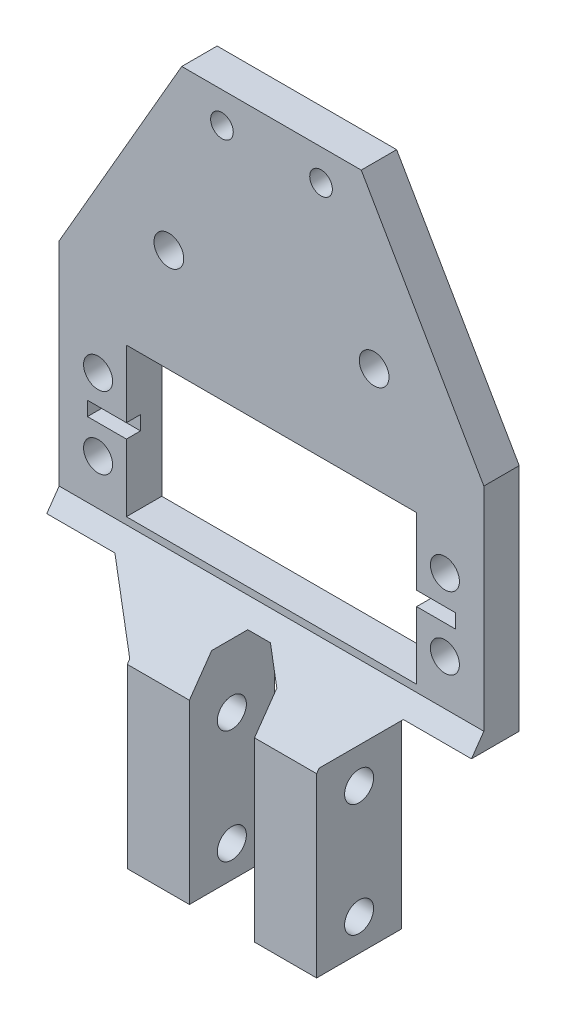
from build123d import *

# Parameters (mm, degrees)
SKETCH2_R           = 2.05
BOSS_EXTRUDE1_DEPTH = 30
CUT_EXTRUDE1_START  = -12.5
SKETCH3_W           = 9.2
SKETCH3_H           = 15
SKETCH3_W_2         = 33.25
CUT_EXTRUDE1_DEPTH  = 32.5
CHAMFER1_SIZE       = 3
CHAMFER2_SIZE       = 7
SKETCH4_R           = 2.05
SKETCH4_W           = 21
SKETCH4_H           = 41
CUT_EXTRUDE2_DEPTH  = 30
SKETCH5_R           = 2.1
SKETCH5_R_2         = 1.6
CUT_EXTRUDE3_DEPTH  = 10
CUT_EXTRUDE4_DEPTH  = 10
CUT_EXTRUDE6_START  = -1
SKETCH8_W           = 2
SKETCH8_H           = 52
CUT_EXTRUDE6_DEPTH  = 2


with BuildPart() as part:
    # Sketch2 → Boss-Extrude1 (new, symmetric)
    with BuildSketch(Plane.YZ):
        Polygon((-12.5, 6), (12.5, 6), (22.5, -1), (82.5, -1), (82.5, -6), (12.5, -6), (-12.5, -6), align=None)
        with Locations(Location((-8, 0, 0), (0, 0, 270))):
            Circle(SKETCH2_R, mode=Mode.SUBTRACT)
        with Locations(Location((8, 0, 0), (0, 0, 90))):
            Circle(SKETCH2_R, mode=Mode.SUBTRACT)
    extrude(amount=BOSS_EXTRUDE1_DEPTH, both=True)

    # Sketch3 → Cut-Extrude1 (cut)
    with BuildSketch(Plane(origin=(0, 0, 0), x_dir=(-1, 0, 0), z_dir=(0, 1, 0)).offset(CUT_EXTRUDE1_START)):
        Rectangle(SKETCH3_W, SKETCH3_H)
        with Locations((-30, 0)):
            Rectangle(SKETCH3_W_2, SKETCH3_H)
        with Locations((30, 0)):
            Rectangle(SKETCH3_W_2, SKETCH3_H)
    extrude(amount=CUT_EXTRUDE1_DEPTH, mode=Mode.SUBTRACT)

    # Chamfer1
    chamfer1_edges = [part.edges().sort_by_distance(p)[0] for p in [
        (-4.6, 20, -2.625),
        (4.6, 20, -2.625),
    ]]
    chamfer(chamfer1_edges, length=CHAMFER1_SIZE)

    # Chamfer2
    chamfer2_edges = [part.edges().sort_by_distance(p)[0] for p in [
        (-13.375, 20, -2.625),
        (13.375, 20, -2.625),
    ]]
    chamfer(chamfer2_edges, length=CHAMFER2_SIZE)

    # Sketch4 → Cut-Extrude2 (cut)
    with BuildSketch(Plane(origin=(0, 0, 0), x_dir=(0, 1, 0), z_dir=(0, 0, 1))):
        with Locations(Location((39.1, 24.5, 0), (0, 0, 270))):
            Circle(SKETCH4_R)
        with Locations(Location((28.9, 24.5, 0), (0, 0, 270))):
            Circle(SKETCH4_R)
        with Locations(Location((28.9, -24.5, 0), (0, 0, 270))):
            Circle(SKETCH4_R)
        with Locations(Location((39.1, -24.5, 0), (0, 0, 270))):
            Circle(SKETCH4_R)
        with Locations((34, 0)):
            Rectangle(SKETCH4_W, SKETCH4_H)
    extrude(amount=-CUT_EXTRUDE2_DEPTH, mode=Mode.SUBTRACT)

    # Sketch5 → Cut-Extrude3 (cut)
    with BuildSketch(Plane(origin=(0, 0, 0), x_dir=(0, 1, 0), z_dir=(0, 0, 1))):
        with Locations(Location((59.1, 14.5, 0), (0, 0, 270))):
            Circle(SKETCH5_R)
        with Locations(Location((59.1, -14.5, 0), (0, 0, 270))):
            Circle(SKETCH5_R)
        with Locations(Location((78.1, 7, 0), (0, 0, 270))):
            Circle(SKETCH5_R_2)
        with Locations(Location((78.1, -7, 0), (0, 0, 270))):
            Circle(SKETCH5_R_2)
    extrude(amount=-CUT_EXTRUDE3_DEPTH, mode=Mode.SUBTRACT)

    # Sketch6 → Cut-Extrude4 (cut)
    with BuildSketch(Plane(origin=(0, 0, 0), x_dir=(0, 1, 0), z_dir=(0, 0, 1))):
        Polygon((52.5, 30), (82.5, 12.679491924), (82.5, -12.679491924), (52.5, -30), (52.5, -35), (87.5, -35), (87.5, 35), (52.5, 35), align=None)
    extrude(amount=-CUT_EXTRUDE4_DEPTH, mode=Mode.SUBTRACT)

    # Sketch8 → Cut-Extrude6 (cut)
    with BuildSketch(Plane(origin=(0, 0, 0), x_dir=(0, 1, 0), z_dir=(0, 0, 1)).offset(CUT_EXTRUDE6_START)):
        with Locations((34, 0)):
            Rectangle(SKETCH8_W, SKETCH8_H)
    extrude(amount=-CUT_EXTRUDE6_DEPTH, mode=Mode.SUBTRACT)


solid = part.part
